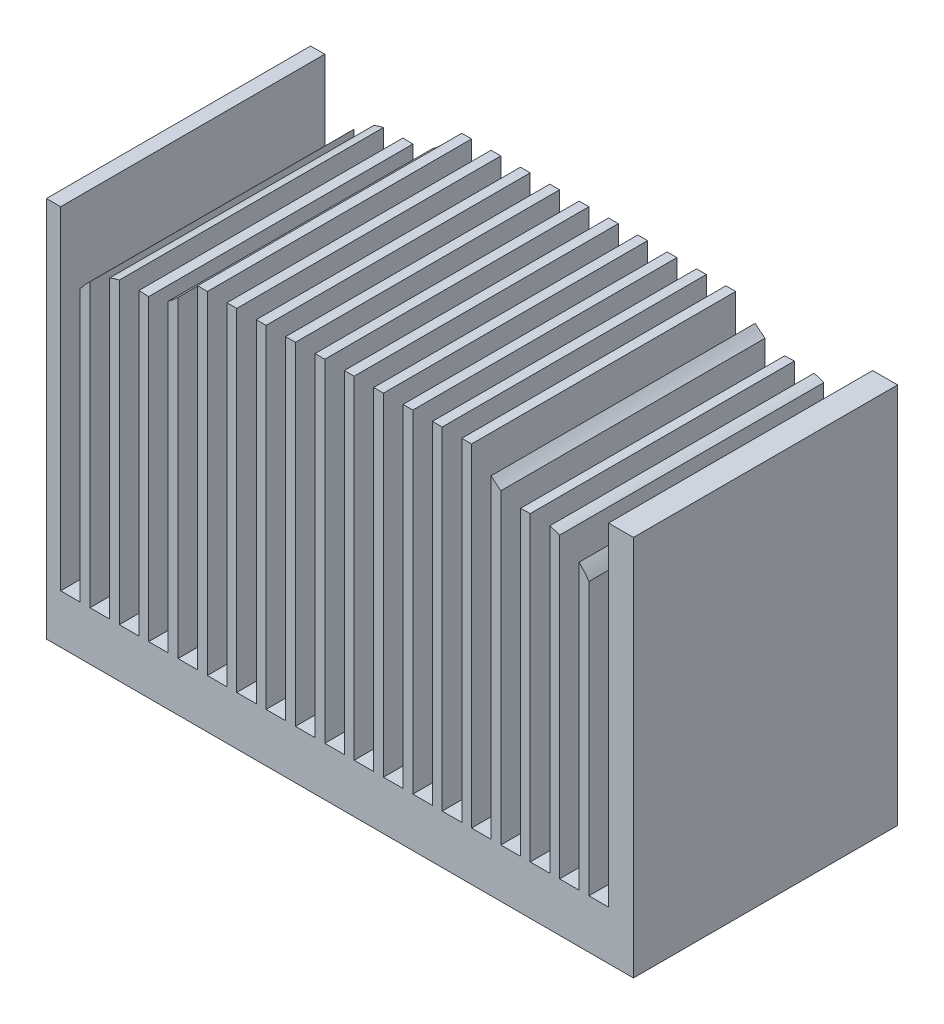
from build123d import *

# Parameters (mm, degrees)
SKETCH1_W           = 60
SKETCH1_H           = 27
BOSS_EXTRUDE1_DEPTH = 39
SKETCH2_W           = 2
SKETCH2_H           = 34
CUT_EXTRUDE1_DEPTH  = 57.124860802
CUT_EXTRUDE3_DEPTH  = 57.124860802
SKETCH4_R           = 2
CUT_EXTRUDE4_DEPTH  = 8


with BuildPart() as part:
    # Sketch1 → Boss-Extrude1 (new body)
    with BuildSketch(Plane(origin=(0, 0, 0), x_dir=(1, 0, 0), z_dir=(0, 1, 0))):
        Rectangle(SKETCH1_W, SKETCH1_H)
    extrude(amount=BOSS_EXTRUDE1_DEPTH)

    # Sketch2 → Cut-Extrude1 (cut, through all)
    with BuildSketch(Plane.XY.offset(13.5)):
        with Locations((-27.547579617, 22)):
            Rectangle(SKETCH2_W, SKETCH2_H)
        with Locations((-24.547579617, 22)):
            Rectangle(SKETCH2_W, SKETCH2_H)
        with Locations((-21.547579617, 22)):
            Rectangle(SKETCH2_W, SKETCH2_H)
        with Locations((-18.547579617, 22)):
            Rectangle(SKETCH2_W, SKETCH2_H)
        with Locations((-15.547579617, 22)):
            Rectangle(SKETCH2_W, SKETCH2_H)
        with Locations((-12.547579617, 22)):
            Rectangle(SKETCH2_W, SKETCH2_H)
        with Locations((-9.547579617, 22)):
            Rectangle(SKETCH2_W, SKETCH2_H)
        with Locations((-6.547579617, 22)):
            Rectangle(SKETCH2_W, SKETCH2_H)
        with Locations((-3.547579617, 22)):
            Rectangle(SKETCH2_W, SKETCH2_H)
        with Locations((-0.547579617, 22)):
            Rectangle(SKETCH2_W, SKETCH2_H)
        with Locations((2.452420383, 22)):
            Rectangle(SKETCH2_W, SKETCH2_H)
        with Locations((5.452420383, 22)):
            Rectangle(SKETCH2_W, SKETCH2_H)
        with Locations((8.452420383, 22)):
            Rectangle(SKETCH2_W, SKETCH2_H)
        with Locations((11.452420383, 22)):
            Rectangle(SKETCH2_W, SKETCH2_H)
        with Locations((14.452420383, 22)):
            Rectangle(SKETCH2_W, SKETCH2_H)
        with Locations((17.452420383, 22)):
            Rectangle(SKETCH2_W, SKETCH2_H)
        with Locations((20.452420383, 22)):
            Rectangle(SKETCH2_W, SKETCH2_H)
        with Locations((23.452420383, 22)):
            Rectangle(SKETCH2_W, SKETCH2_H)
        with Locations((26.452420383, 22)):
            Rectangle(SKETCH2_W, SKETCH2_H)
    extrude(amount=-CUT_EXTRUDE1_DEPTH, mode=Mode.SUBTRACT)

    # Sketch3 → Cut-Extrude3 (cut, through all)
    with BuildSketch(Plane.XY.offset(13.5)):
        with BuildLine():
            Line((-27.287287873, 31.63968808), (-27.287287873, 46.957056172))
            Line((-27.287287873, 46.957056172), (-15.852202016, 46.957056172))
            Line((-15.852202016, 46.957056172), (-15.852202016, 37.639578807))
            add(Edge.make_bspline(
                [(-27.287287873, 31.63968808), (-26.200637695, 33.558838302), (-23.315795358, 36.3085812), (-18.326735295, 35.092691563), (-16.812611734, 36.72693063), (-15.852202016, 37.639578807)],
                knots=[0, 0, 0, 0, 0.219184667, 0.330933092, 0.438557928, 0.438557928, 0.438557928, 0.438557928], degree=3))
        make_face()
        with BuildLine():
            Line((14.711947218, 37.89188102), (14.711947218, 46.957056172))
            Line((14.711947218, 46.957056172), (26.147033074, 46.957056172))
            Line((26.147033074, 46.957056172), (26.147033074, 31.63968808))
            add(Edge.make_bspline(
                [(26.147033074, 31.63968808), (25.060382896, 33.838916018), (22.175540559, 36.554428958), (17.186480496, 35.346246919), (15.672356936, 36.979232843), (14.711947218, 37.89188102)],
                knots=[0, 0, 0, 0, 0.219184667, 0.330933092, 0.438557928, 0.438557928, 0.438557928, 0.438557928], degree=3))
        make_face()
    extrude(amount=-CUT_EXTRUDE3_DEPTH, mode=Mode.SUBTRACT)

    # Sketch4 → Cut-Extrude4 (cut)
    with BuildSketch(Plane.XZ):
        with Locations(Location((-26.860961127, 0, 0), (0, 0, 270))):
            Circle(SKETCH4_R)
        with Locations(Location((26.860961127, 0, 0), (0, 0, 287.20129422))):
            Circle(SKETCH4_R)
    extrude(amount=-CUT_EXTRUDE4_DEPTH, mode=Mode.SUBTRACT)


solid = part.part
